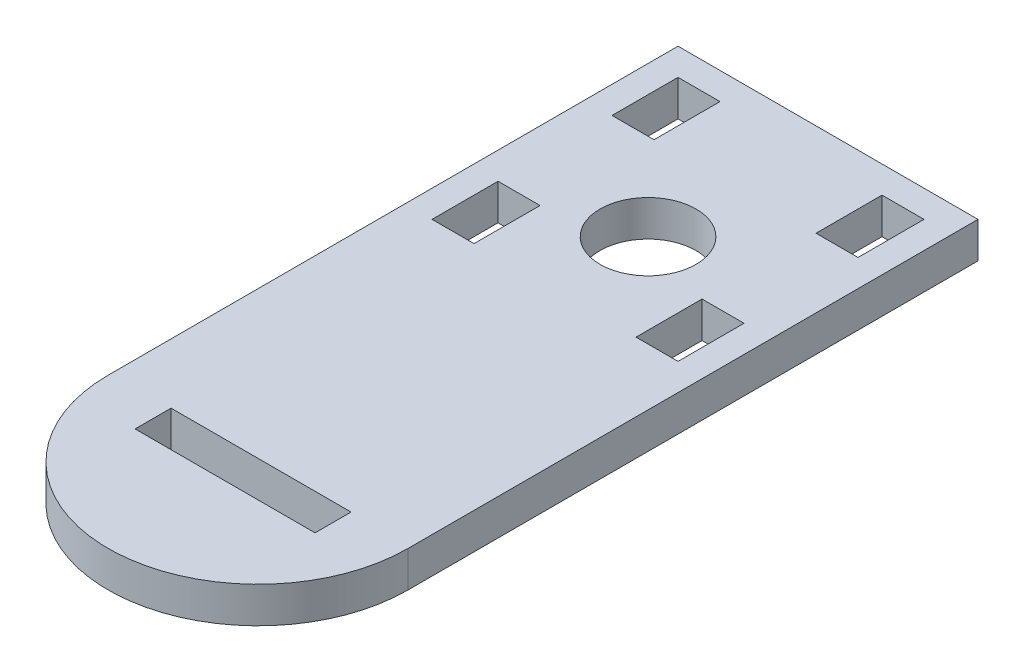
from build123d import *

# Parameters (mm, degrees)
SKETCH1_R           = 4
SKETCH1_W           = 3.5
SKETCH1_H           = 5.5
SKETCH1_W_2         = 15
SKETCH1_H_2         = 3
BOSS_EXTRUDE1_DEPTH = 3


with BuildPart() as part:
    # Sketch1 → Boss-Extrude1 (new body)
    with BuildSketch(Plane(origin=(0, 0, 0), x_dir=(1, 0, 0), z_dir=(0, 1, 0))):
        with BuildLine():
            Line((0, 0), (-25, 0))
            Line((-25, 0), (-25, -47.5))
            ThreePointArc((-25, -47.5), (-12.5, -60), (0, -47.5))
            Line((0, -47.5), (0, 0))
        make_face()
        with Locations(Location((-12.5, -15, 0), (0, 0, 270))):
            Circle(SKETCH1_R, mode=Mode.SUBTRACT)
        with Locations((-21, -5)):
            Rectangle(SKETCH1_W, SKETCH1_H, mode=Mode.SUBTRACT)
        with Locations((-4, -5)):
            Rectangle(SKETCH1_W, SKETCH1_H, mode=Mode.SUBTRACT)
        with Locations((-21, -20)):
            Rectangle(SKETCH1_W, SKETCH1_H, mode=Mode.SUBTRACT)
        with Locations((-4, -20)):
            Rectangle(SKETCH1_W, SKETCH1_H, mode=Mode.SUBTRACT)
        with Locations((-12.5, -48.75)):
            Rectangle(SKETCH1_W_2, SKETCH1_H_2, mode=Mode.SUBTRACT)
    extrude(amount=BOSS_EXTRUDE1_DEPTH)


solid = part.part
